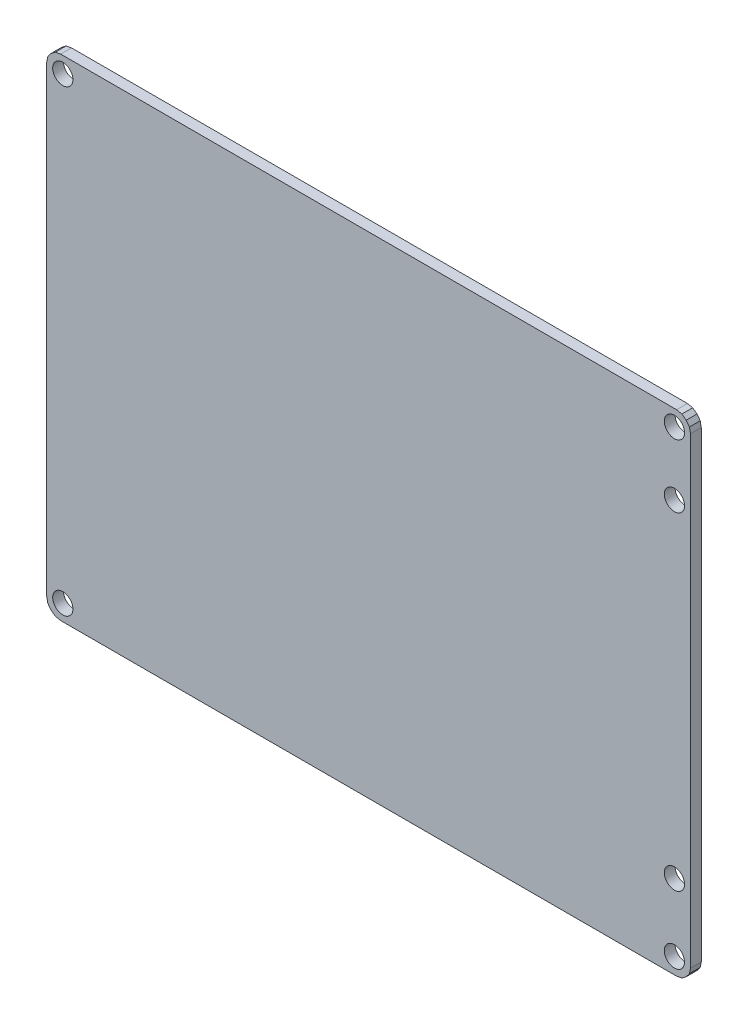
from build123d import *

# Parameters (mm, degrees)
SKETCH_1_R      = 1.5
EXTRUDE_1_DEPTH = 1.6


with BuildPart() as part:
    # Эскиз1 → Бобышка-Вытянуть1 (new body)
    with BuildSketch(Plane.XY):
        Polygon((45.640633333, -36.353733333), (-45.640633333, -36.353733333), (-46.434366667, -36.195), (-47.069366667, -35.718733333), (-47.545633333, -35.083733333), (-47.704366667, -34.29), (-47.704366667, 34.29), (-47.545633333, 35.083733333), (-47.069366667, 35.718733333), (-46.434366667, 36.195), (-45.640633333, 36.353733333), (45.640633333, 36.353733333), (46.434366667, 36.195), (47.069366667, 35.718733333), (47.545633333, 35.083733333), (47.704366667, 34.29), (47.704366667, -34.29), (47.545633333, -35.083733333), (47.069366667, -35.718733333), (46.434366667, -36.195), align=None)
        with Locations((-45.323133333, -33.9725)):
            Circle(SKETCH_1_R, mode=Mode.SUBTRACT)
        with Locations((-45.322866667, 33.972733333)):
            Circle(SKETCH_1_R, mode=Mode.SUBTRACT)
        with Locations((45.3231, 33.9725)):
            Circle(SKETCH_1_R, mode=Mode.SUBTRACT)
        with Locations((45.323133333, 24.606266667)):
            Circle(SKETCH_1_R, mode=Mode.SUBTRACT)
        with Locations((45.3231, -33.9725)):
            Circle(SKETCH_1_R, mode=Mode.SUBTRACT)
        with Locations((45.3231, -23.971266667)):
            Circle(SKETCH_1_R, mode=Mode.SUBTRACT)
    extrude(amount=EXTRUDE_1_DEPTH)


solid = part.part
